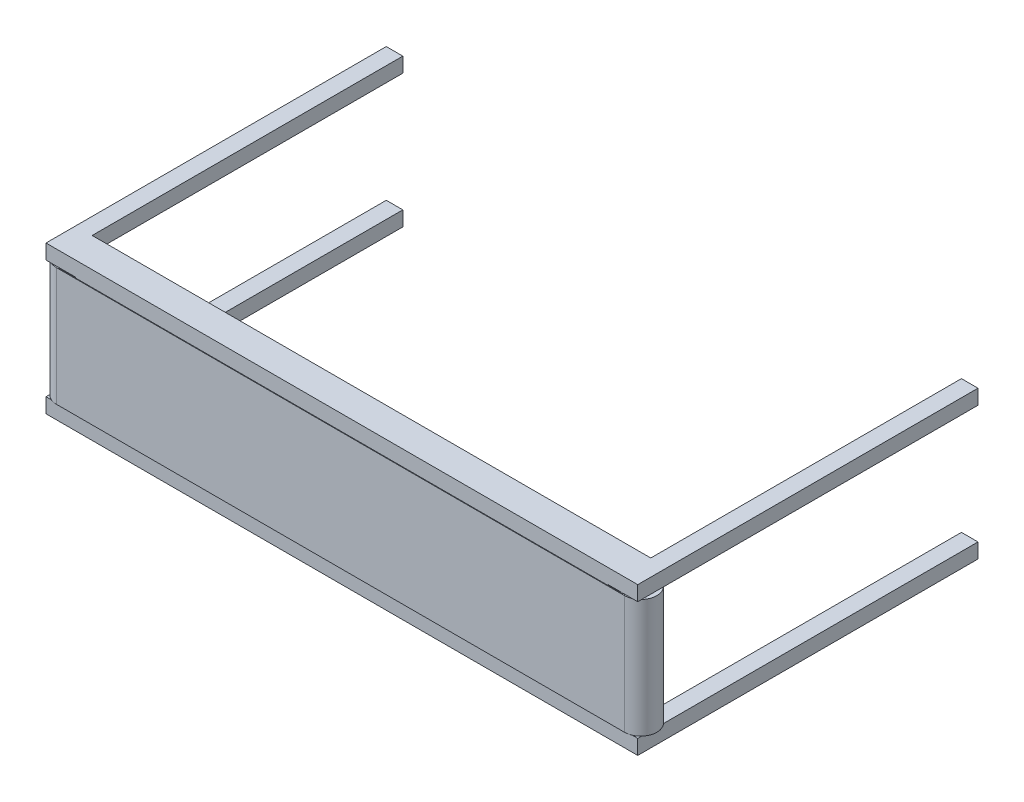
from build123d import *

# Parameters (mm, degrees)
BOSS_EXTRUDE1_DEPTH = 100
SKETCH2_R           = 52.5
BOSS_EXTRUDE2_DEPTH = 400
BOSS_EXTRUDE3_START = -400
BOSS_EXTRUDE3_DEPTH = 400
SKETCH4_W           = 56.007810594
SKETCH4_H           = 50
BOSS_EXTRUDE4_DEPTH = 1050


with BuildPart() as part:
    # Sketch1 → Boss-Extrude1 (new body)
    with BuildSketch(Plane.XY):
        Polygon((-1000, 200), (-900, 200), (-900, -200), (-1000, -200), (-1000, -250), (1000, -250), (1000, -200), (900, -200), (900, 200), (1000, 200), (1000, 250), (-1000, 250), align=None)
    extrude(amount=BOSS_EXTRUDE1_DEPTH)

    # Sketch2 → Boss-Extrude2 (add)
    with BuildSketch(Plane.XZ.offset(-200)):
        with Locations(Location((960, 50, 0), (0, 0, 107.752790162))):
            Circle(SKETCH2_R)
    boss_extrude2 = extrude(amount=BOSS_EXTRUDE2_DEPTH)

    # Mirror1: Boss-Extrude2 across plane
    add(boss_extrude2.mirror(Plane(origin=(0, 0, 0), x_dir=(0, 0, 1), z_dir=(1, 0, 0))))

    # Sketch3 → Boss-Extrude3 (add)
    with BuildSketch(Plane.XZ.offset(200).offset(BOSS_EXTRUDE3_START)):
        with BuildLine():
            Line((959.98965758, -4.499999019), (-1002.277476215, 15.607195449))
            ThreePointArc((-1002.277476215, 15.607195449), (-1009.217160869, 73.407714027), (-960, 104.5))
            Line((-960, 104.5), (960, 104.5))
            ThreePointArc((960, 104.5), (1014.499999755, 49.99482879), (959.98965758, -4.499999019))
        make_face()
        with BuildLine():
            Line((-960, 102.5), (960, 102.5))
            ThreePointArc((960, 102.5), (1012.5, 50), (960, -2.5))
            Line((960, -2.5), (-1001.307615203, 17.597362357))
            ThreePointArc((-1001.307615203, 17.597362357), (-1007.209048265, 72.96858206), (-960, 102.5))
        make_face(mode=Mode.SUBTRACT)
    extrude(amount=BOSS_EXTRUDE3_DEPTH)

    # Sketch4 → Boss-Extrude4 (add)
    with BuildSketch(Plane(origin=(0, 0, 0), x_dir=(-1, 0, 0), z_dir=(0, 0, -1))):
        with Locations((-971.996094703, 225)):
            Rectangle(SKETCH4_W, SKETCH4_H)
        with Locations((971.996094703, 225)):
            Rectangle(SKETCH4_W, SKETCH4_H)
        with Locations((971.996094703, -225)):
            Rectangle(SKETCH4_W, SKETCH4_H)
        with Locations((-971.996094703, -225)):
            Rectangle(SKETCH4_W, SKETCH4_H)
    extrude(amount=BOSS_EXTRUDE4_DEPTH)


solid = part.part
